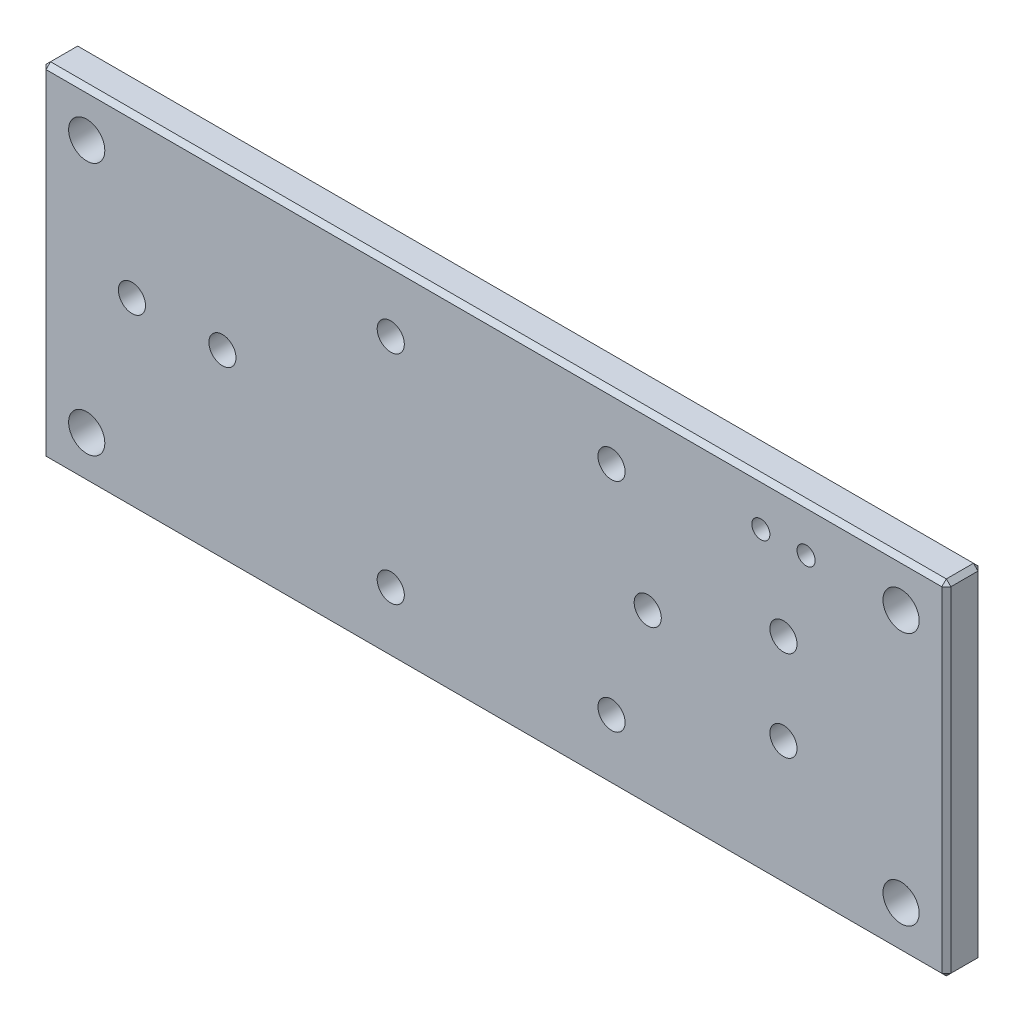
from build123d import *

# Parameters (mm, degrees)
SKETCH_1_W          = 50
SKETCH_1_H          = 19
SKETCH_1_R          = 1
EXTRUDE_1_DEPTH     = 2
SKETCH_2_R          = 0.75
SKETCH_2_R_2        = 0.5
CUT_EXTRUDE_1_DEPTH = 2
CHAMFER_1_SIZE      = 0.25


with BuildPart() as part:
    # Эскиз1 → Бобышка-Вытянуть1 (new body)
    with BuildSketch(Plane.XY):
        Rectangle(SKETCH_1_W, SKETCH_1_H)
        with Locations((-22.5, 7)):
            Circle(SKETCH_1_R, mode=Mode.SUBTRACT)
        with Locations((22.5, 7)):
            Circle(SKETCH_1_R, mode=Mode.SUBTRACT)
        with Locations((22.5, -7)):
            Circle(SKETCH_1_R, mode=Mode.SUBTRACT)
        with Locations((-22.5, -7)):
            Circle(SKETCH_1_R, mode=Mode.SUBTRACT)
    extrude(amount=EXTRUDE_1_DEPTH)

    # Эскиз2 → Вырез-Вытянуть1 (cut)
    with BuildSketch(Plane.XY.offset(2)):
        with Locations((-5.7, 6)):
            Circle(SKETCH_2_R)
        with Locations((-5.7, -6)):
            Circle(SKETCH_2_R)
        with Locations((6.5, 6)):
            Circle(SKETCH_2_R)
        with Locations((6.5, -6)):
            Circle(SKETCH_2_R)
        with Locations((8.5, 0)):
            Circle(SKETCH_2_R)
        with Locations((16, 2.5)):
            Circle(SKETCH_2_R)
        with Locations((16, -2.5)):
            Circle(SKETCH_2_R)
        with Locations((14.75, 7)):
            Circle(SKETCH_2_R_2)
        with Locations((-20, 0.7)):
            Circle(SKETCH_2_R)
        with Locations((-15, 0.7)):
            Circle(SKETCH_2_R)
        with Locations((17.25, 7)):
            Circle(SKETCH_2_R_2)
    extrude(amount=-CUT_EXTRUDE_1_DEPTH, mode=Mode.SUBTRACT)

    # Фаска1
    chamfer_1_edges = [part.edges().sort_by_distance(p)[0] for p in [
        (-25, 0, 2),
        (0, -9.5, 2),
        (25, 0, 2),
        (0, -9.5, 0),
        (-25, 0, 0),
        (0, 9.5, 0),
        (25, 0, 0),
        (0, 9.5, 2),
        (25, -9.5, 1),
        (-25, -9.5, 1),
        (-25, 9.5, 1),
        (25, 9.5, 1),
    ]]
    chamfer(chamfer_1_edges, length=CHAMFER_1_SIZE)


solid = part.part
